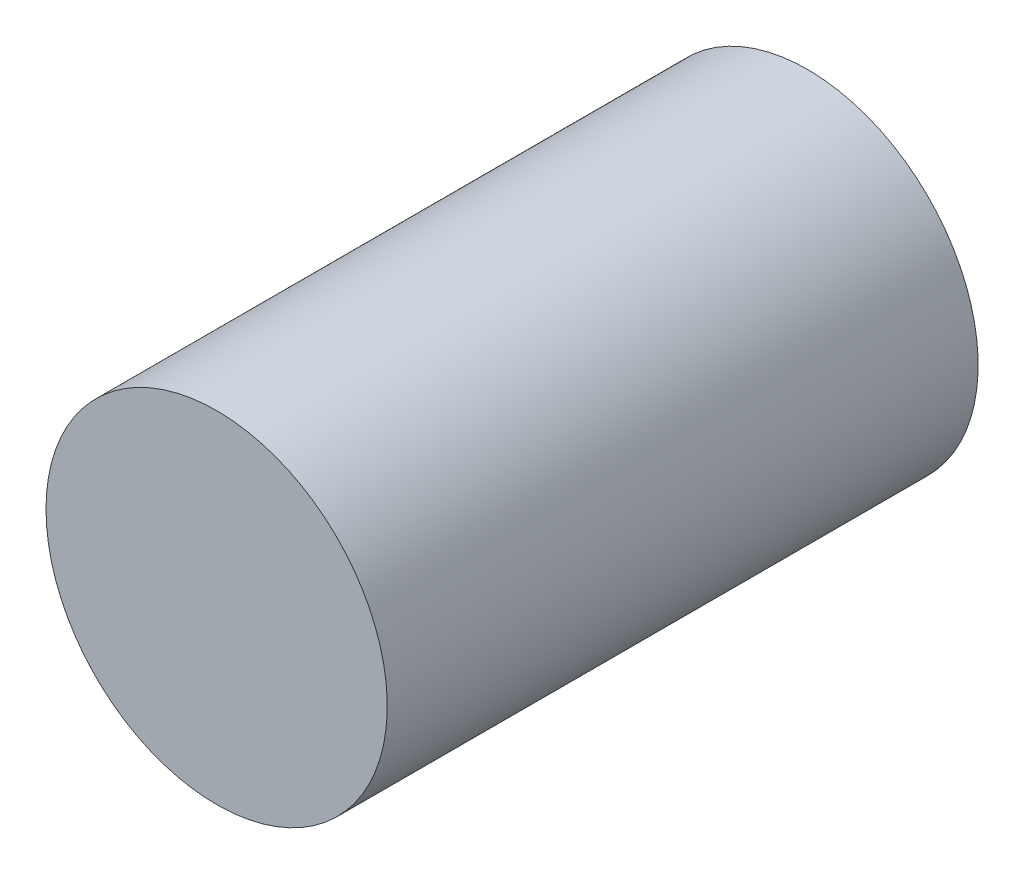
from build123d import *

# Parameters (mm, degrees)
SKETCH1_R           = 17.325
BOSS_EXTRUDE1_DEPTH = 60


with BuildPart() as part:
    # Sketch1 → Boss-Extrude1 (new body)
    with BuildSketch(Plane.XY):
        with Locations(Location((0, 0, 0), (0, 0, 180))):
            Circle(SKETCH1_R)
    extrude(amount=BOSS_EXTRUDE1_DEPTH)


solid = part.part
